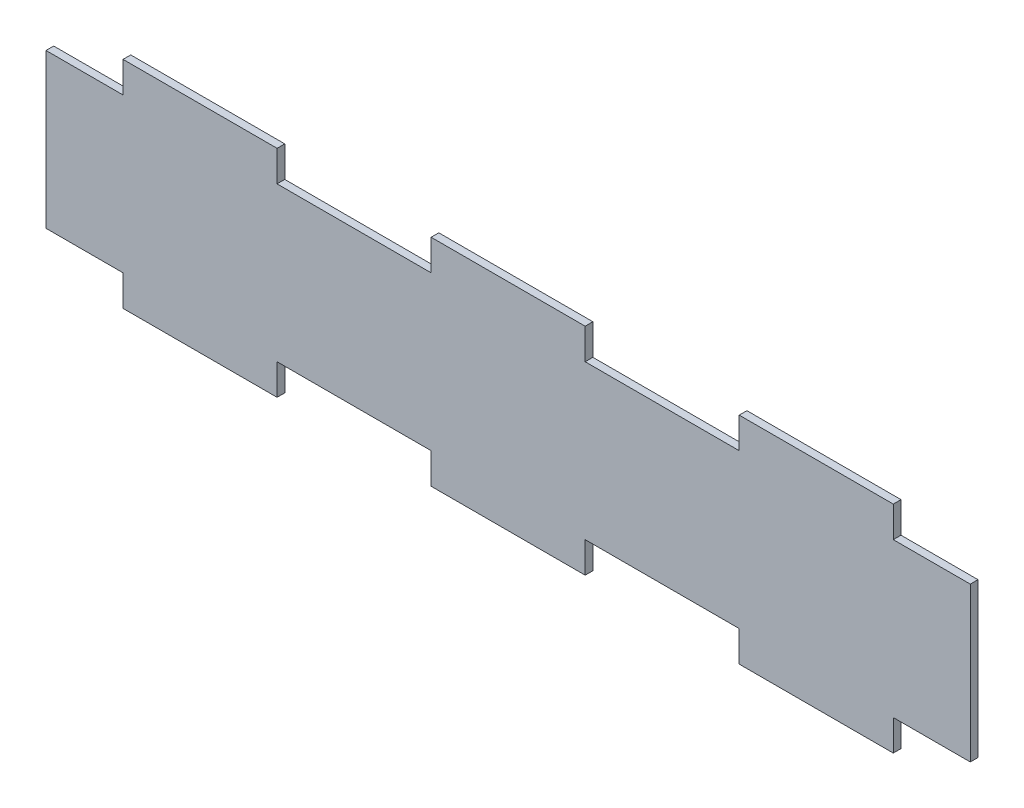
from build123d import *

# Parameters (mm, degrees)
BOSS_EXTRUDE1_DEPTH = 5


with BuildPart() as part:
    # Sketch1 → Boss-Extrude1 (new body)
    with BuildSketch(Plane.XY):
        Polygon((550, 100), (600, 100), (600, 120), (700, 120), (700, 100), (800, 100), (800, 120), (900, 120), (900, 100), (1000, 100), (1000, 120), (1100, 120), (1100, 100), (1150, 100), (1150, 0), (1100, 0), (1100, -20), (1000, -20), (1000, 0), (900, 0), (900, -20), (800, -20), (800, 0), (700, 0), (700, -20), (600, -20), (600, 0), (550, 0), align=None)
    extrude(amount=BOSS_EXTRUDE1_DEPTH)


solid = part.part
